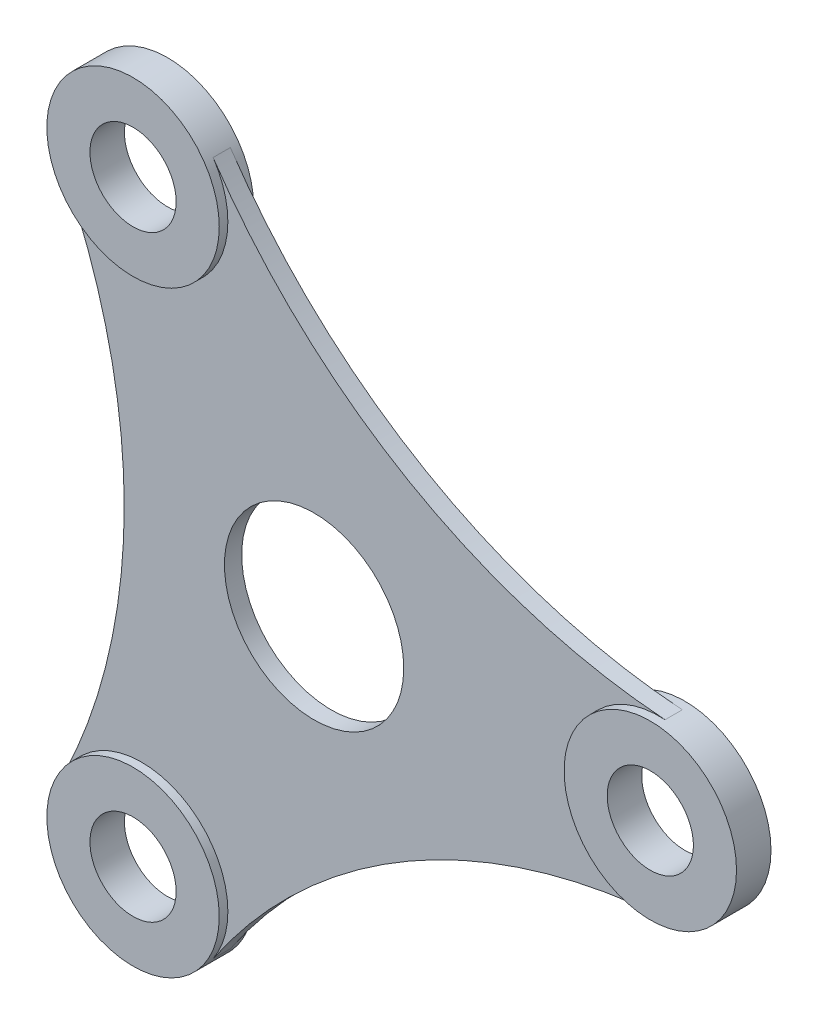
from build123d import *

# Parameters (mm, degrees)
SKETCH1_R             = 50
SKETCH1_R_2           = 25
BOSS_EXTRUDE1_DEPTH   = 10
BOSS_EXTRUDE1_2_DEPTH = 10
BOSS_EXTRUDE1_3_DEPTH = 10
SKETCH1_3_R           = 52
BOSS_EXTRUDE2_DEPTH   = 5


with BuildPart() as part:
    # Sketch1 → Boss-Extrude1 (new, symmetric)
    with BuildSketch(Plane.XY):
        with Locations((200, 0)):
            Circle(SKETCH1_R)
        with Locations((200, 0)):
            Circle(SKETCH1_R_2, mode=Mode.SUBTRACT)
    extrude(amount=BOSS_EXTRUDE1_DEPTH, both=True)



with BuildPart() as body_2:
    # Sketch1 → Boss-Extrude1 2 (new, symmetric)
    with BuildSketch(Plane.XY):
        with Locations((-100, 173.205080757)):
            Circle(SKETCH1_R)
        with Locations((-100, 173.205080757)):
            Circle(SKETCH1_R_2, mode=Mode.SUBTRACT)
    extrude(amount=BOSS_EXTRUDE1_2_DEPTH, both=True)


with BuildPart() as body_3:
    # Sketch1 → Boss-Extrude1 3 (new, symmetric)
    with BuildSketch(Plane.XY):
        with Locations((-100, -173.205080757)):
            Circle(SKETCH1_R)
        with Locations((-100, -173.205080757)):
            Circle(SKETCH1_R_2, mode=Mode.SUBTRACT)
    extrude(amount=BOSS_EXTRUDE1_3_DEPTH, both=True)


with BuildPart() as part_1:
    add(part.part)

    add(body_2.part)  # Boss-Extrude2 merges body 2

    add(body_3.part)  # Boss-Extrude2 merges body 3
    # Sketch1<3> → Boss-Extrude2 (add, symmetric)
    with BuildSketch(Plane.XY):
        with BuildLine():
            ThreePointArc((203.542445822, -49.874352904), (150, 0), (203.542445822, 49.874352904))
            ThreePointArc((203.542445822, 49.874352904), (55.056170912, 95.360085291), (-58.578766299, 201.210105283))
            ThreePointArc((-58.578766299, 201.210105283), (-52.19277416, 187.849846288), (-50, 173.205080757))
            ThreePointArc((-50, 173.205080757), (-88.779126063, 124.480425929), (-144.963679523, 151.335752378))
            ThreePointArc((-144.963679523, 151.335752378), (-110.112341825, 0), (-144.963679523, -151.335752378))
            ThreePointArc((-144.963679523, -151.335752378), (-88.779126063, -124.480425929), (-50, -173.205080757))
            ThreePointArc((-50, -173.205080757), (-52.19277416, -187.849846288), (-58.578766299, -201.210105283))
            ThreePointArc((-58.578766299, -201.210105283), (55.056170912, -95.360085291), (203.542445822, -49.874352904))
        make_face()
        Circle(SKETCH1_3_R, mode=Mode.SUBTRACT)
    extrude(amount=BOSS_EXTRUDE2_DEPTH, both=True)


solid = part_1.part
